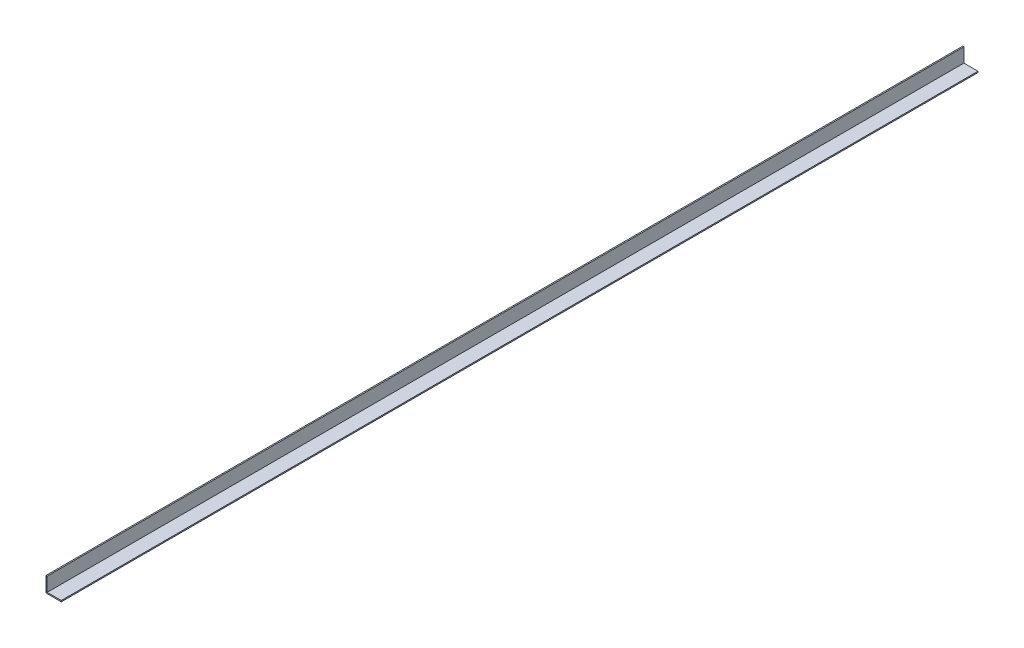
from build123d import *

# Parameters (mm, degrees)
SALIENTE_EXTRUIR1_DEPTH = 6100


with BuildPart() as part:
    # Croquis1 → Saliente-Extruir1 (new body)
    with BuildSketch(Plane.XY):
        Polygon((0, 101.6), (0, 0), (101.6, 0), (101.6, 7.94), (7.94, 7.94), (7.94, 101.6), align=None)
    extrude(amount=-SALIENTE_EXTRUIR1_DEPTH)


solid = part.part
